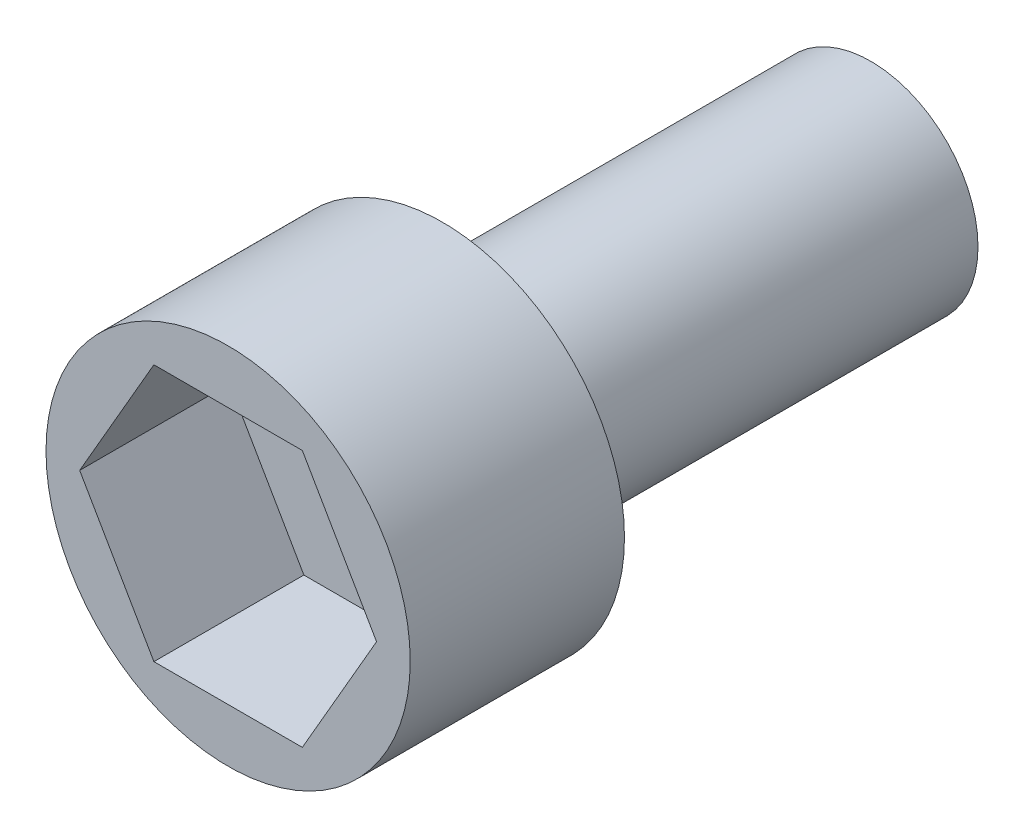
from build123d import *

# Parameters (mm, degrees)
ESQUISSE1_R             = 2.5
BOSS_EXTRU_1_DEPTH      = 10
ESQUISSE2_R             = 4.25
BOSS_EXTRU_2_DEPTH      = 5
ENL_V_MAT_EXTRU_1_DEPTH = 3.5


with BuildPart() as part:
    # Esquisse1 → Boss.-Extru.1 (new body)
    with BuildSketch(Plane.XY):
        Circle(ESQUISSE1_R)
    extrude(amount=BOSS_EXTRU_1_DEPTH)

    # Esquisse2 → Boss.-Extru.2 (add)
    with BuildSketch(Plane.XY.offset(10)):
        Circle(ESQUISSE2_R)
    extrude(amount=BOSS_EXTRU_2_DEPTH)

    # Esquisse3 → Enlèv. mat.-Extru.1 (cut)
    with BuildSketch(Plane.XY.offset(15)):
        Polygon((3.464101615, 0), (1.732050808, 3), (-1.732050808, 3), (-3.464101615, 0), (-1.732050808, -3), (1.732050808, -3), align=None)
    extrude(amount=-ENL_V_MAT_EXTRU_1_DEPTH, mode=Mode.SUBTRACT)


solid = part.part
